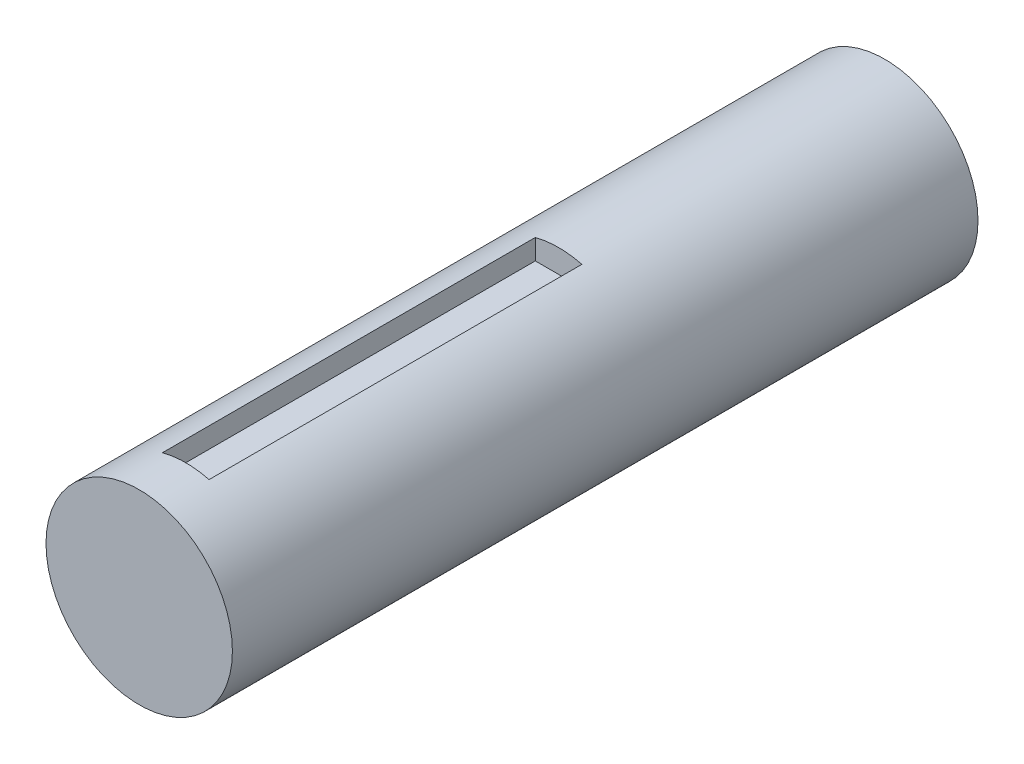
from build123d import *

# Parameters (mm, degrees)
SKETCH1_R           = 10
BOSS_EXTRUDE1_DEPTH = 80
SKETCH3_W           = 5
SKETCH3_H           = 5
CUT_EXTRUDE1_DEPTH  = 40


with BuildPart() as part:
    # Sketch1 → Boss-Extrude1 (new body)
    with BuildSketch(Plane.XY):
        Circle(SKETCH1_R)
    extrude(amount=BOSS_EXTRUDE1_DEPTH)

    # Sketch3 → Cut-Extrude1 (cut)
    with BuildSketch(Plane(origin=(0, 0, 75), x_dir=(-1, 0, 0), z_dir=(0, 0, -1))):
        with Locations((0, 10)):
            Rectangle(SKETCH3_W, SKETCH3_H)
    extrude(amount=CUT_EXTRUDE1_DEPTH, mode=Mode.SUBTRACT)


solid = part.part
